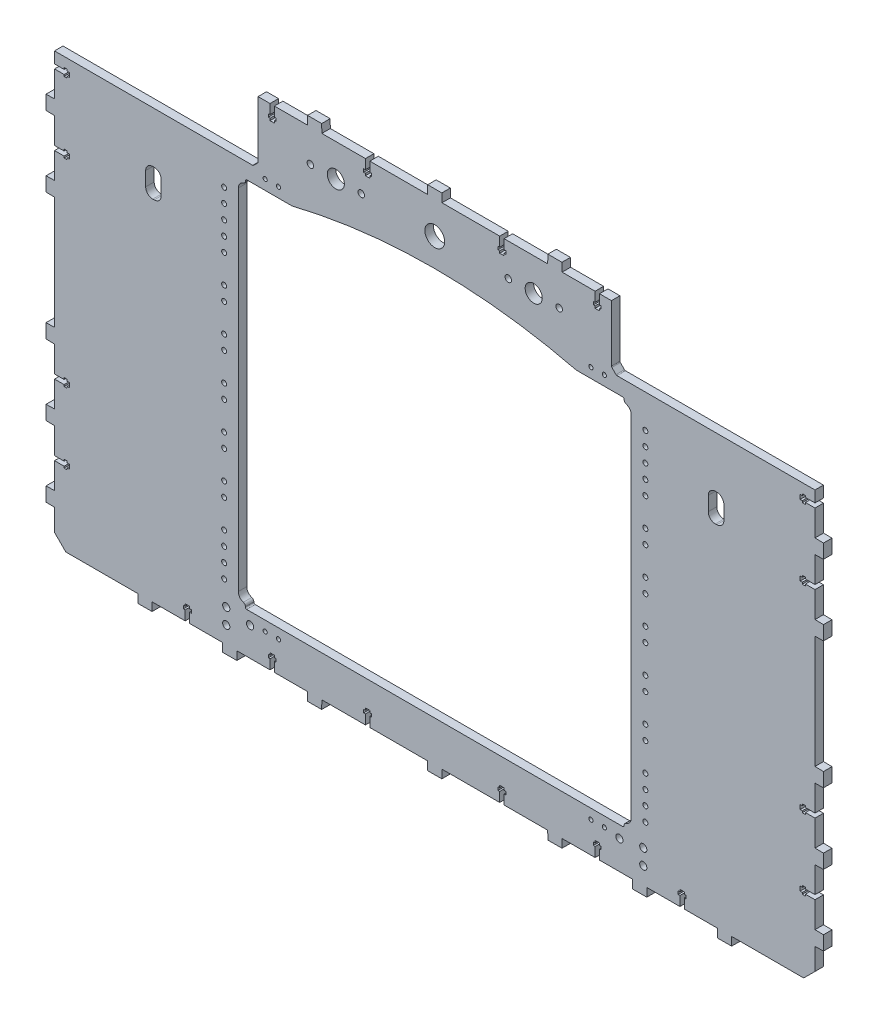
from build123d import *

# Parameters (mm, degrees)
SKETCH_1_R      = 1.75
SKETCH_1_R_2    = 2.55
SKETCH_1_R_3    = 1.5
SKETCH_1_R_4    = 2.3
SKETCH_1_R_5    = 6.05
SKETCH_1_R_6    = 7
EXTRUDE_1_DEPTH = 6


with BuildPart() as part:
    # Эскиз1 → Бобышка-Вытянуть1 (new body)
    with BuildSketch(Plane.XY):
        with BuildLine():
            Line((1433.580450761, 343.057239019), (1435.080450761, 343.057239019))
            Line((1435.080450761, 343.057239019), (1435.080450761, 339.95723902))
            Line((1435.080450761, 339.95723902), (1433.580450761, 339.95723902))
            Line((1433.580450761, 339.95723902), (1433.580450761, 338.75723902))
            Line((1433.580450761, 338.75723902), (1431.380450761, 338.75723902))
            Line((1431.380450761, 338.75723902), (1431.380450761, 339.95723902))
            Line((1431.380450761, 339.95723902), (1424.580450761, 339.95723902))
            Line((1424.580450761, 339.95723902), (1424.580450761, 321.60723902))
            Line((1424.580450761, 321.60723902), (1418.580450762, 321.50723902))
            Line((1418.580450762, 321.50723902), (1418.580450762, 311.50723902))
            Line((1418.580450762, 311.50723902), (1424.580450761, 311.407239019))
            Line((1424.580450761, 311.407239019), (1424.580450761, 293.05723902))
            Line((1424.580450761, 293.05723902), (1431.380450761, 293.05723902))
            Line((1431.380450761, 293.05723902), (1431.380450761, 294.25723902))
            Line((1431.380450761, 294.25723902), (1433.580450761, 294.25723902))
            Line((1433.580450761, 294.25723902), (1433.580450761, 293.05723902))
            Line((1433.580450761, 293.05723902), (1435.080450761, 293.05723902))
            Line((1435.080450761, 293.05723902), (1435.080450761, 289.95723902))
            Line((1435.080450761, 289.95723902), (1433.580450761, 289.95723902))
            Line((1433.580450761, 289.95723902), (1433.580450761, 288.75723902))
            Line((1433.580450761, 288.75723902), (1431.380450761, 288.75723902))
            Line((1431.380450761, 288.75723902), (1431.380450761, 289.95723902))
            Line((1431.380450761, 289.95723902), (1424.580450761, 289.95723902))
            Line((1424.580450761, 289.95723902), (1424.580450761, 271.60723902))
            Line((1424.580450761, 271.60723902), (1418.580450762, 271.50723902))
            Line((1418.580450762, 271.50723902), (1418.580450762, 261.50723902))
            Line((1418.580450762, 261.50723902), (1424.580450761, 261.407239019))
            Line((1424.580450761, 261.407239019), (1424.580450761, 181.60723902))
            Line((1424.580450761, 181.60723902), (1418.580450762, 181.50723902))
            Line((1418.580450762, 181.50723902), (1418.580450762, 171.50723902))
            Line((1418.580450762, 171.50723902), (1424.58045076, 171.407239019))
            Line((1424.58045076, 171.407239019), (1424.58045076, 153.05723902))
            Line((1424.58045076, 153.05723902), (1431.38045076, 153.05723902))
            Line((1431.38045076, 153.05723902), (1431.38045076, 154.257239019))
            Line((1431.38045076, 154.257239019), (1433.58045076, 154.257239019))
            Line((1433.58045076, 154.257239019), (1433.58045076, 153.057239019))
            Line((1433.58045076, 153.057239019), (1435.08045076, 153.057239019))
            Line((1435.08045076, 153.057239019), (1435.08045076, 149.957239019))
            Line((1435.08045076, 149.957239019), (1433.58045076, 149.957239019))
            Line((1433.58045076, 149.957239019), (1433.58045076, 148.757239019))
            Line((1433.58045076, 148.757239019), (1431.38045076, 148.757239019))
            Line((1431.38045076, 148.757239019), (1431.38045076, 149.957239019))
            Line((1431.38045076, 149.957239019), (1424.58045076, 149.957239019))
            Line((1424.58045076, 149.957239019), (1424.58045076, 131.607239019))
            Line((1424.58045076, 131.607239019), (1418.580450762, 131.507239019))
            Line((1418.580450762, 131.507239019), (1418.580450762, 121.507239019))
            Line((1418.580450762, 121.507239019), (1424.58045076, 121.407239018))
            Line((1424.58045076, 121.407239018), (1424.58045076, 103.057239019))
            Line((1424.58045076, 103.057239019), (1431.38045076, 103.057239019))
            Line((1431.38045076, 103.057239019), (1431.38045076, 104.257239019))
            Line((1431.38045076, 104.257239019), (1433.58045076, 104.257239019))
            Line((1433.58045076, 104.257239019), (1433.58045076, 103.057239019))
            Line((1433.58045076, 103.057239019), (1435.08045076, 103.057239019))
            Line((1435.08045076, 103.057239019), (1435.08045076, 99.957239019))
            Line((1435.08045076, 99.957239019), (1433.58045076, 99.957239019))
            Line((1433.58045076, 99.957239019), (1433.58045076, 98.757239019))
            Line((1433.58045076, 98.757239019), (1431.38045076, 98.757239019))
            Line((1431.38045076, 98.757239019), (1431.38045076, 99.957239019))
            Line((1431.38045076, 99.957239019), (1424.58045076, 99.957239019))
            Line((1424.58045076, 99.957239019), (1424.58045076, 81.607239019))
            Line((1424.58045076, 81.607239019), (1418.580450762, 81.507239019))
            Line((1418.580450762, 81.507239019), (1418.580450762, 71.507239019))
            Line((1418.580450762, 71.507239019), (1424.58045076, 71.407239018))
            Line((1424.58045076, 71.407239018), (1424.58045076, 56.007239019))
            Line((1424.58045076, 56.007239019), (1432.58045076, 48.007239019))
            Line((1432.58045076, 48.007239019), (1483.480450759, 48.007239019))
            Line((1483.480450759, 48.007239019), (1483.58045076, 42.00723902))
            Line((1483.58045076, 42.00723902), (1493.58045076, 42.00723902))
            Line((1493.58045076, 42.00723902), (1493.68045076, 48.007239019))
            Line((1493.68045076, 48.007239019), (1517.03045076, 48.007239019))
            Line((1517.03045076, 48.007239019), (1517.03045076, 54.807239019))
            Line((1517.03045076, 54.807239019), (1515.830450761, 54.807239019))
            Line((1515.830450761, 54.807239019), (1515.830450761, 57.007239019))
            Line((1515.830450761, 57.007239019), (1517.030450761, 57.007239019))
            Line((1517.030450761, 57.007239019), (1517.030450761, 58.507239019))
            Line((1517.030450761, 58.507239019), (1520.130450761, 58.507239019))
            Line((1520.130450761, 58.507239019), (1520.130450761, 57.007239019))
            Line((1520.130450761, 57.007239019), (1521.330450761, 57.007239019))
            Line((1521.330450761, 57.007239019), (1521.330450761, 54.807239019))
            Line((1521.330450761, 54.807239019), (1520.130450761, 54.807239019))
            Line((1520.130450761, 54.807239019), (1520.130450761, 48.007239019))
            Line((1520.130450761, 48.007239019), (1532.58045076, 48.007239019))
            Line((1532.58045076, 48.007239019), (1543.48045076, 48.007239019))
            Line((1543.48045076, 48.007239019), (1543.580450761, 42.00723902))
            Line((1543.580450761, 42.00723902), (1553.580450761, 42.00723902))
            Line((1553.580450761, 42.00723902), (1553.680450761, 48.007239018))
            Line((1553.680450761, 48.007239018), (1577.030450761, 48.007239018))
            Line((1577.030450761, 48.007239018), (1577.030450761, 54.807239018))
            Line((1577.030450761, 54.807239018), (1575.830450761, 54.807239018))
            Line((1575.830450761, 54.807239018), (1575.830450761, 57.007239018))
            Line((1575.830450761, 57.007239018), (1577.030450761, 57.007239018))
            Line((1577.030450761, 57.007239018), (1577.030450761, 58.507239018))
            Line((1577.030450761, 58.507239018), (1580.130450761, 58.507239018))
            Line((1580.130450761, 58.507239018), (1580.130450761, 57.007239018))
            Line((1580.130450761, 57.007239018), (1581.330450761, 57.007239018))
            Line((1581.330450761, 57.007239018), (1581.330450761, 54.807239018))
            Line((1581.330450761, 54.807239018), (1580.130450761, 54.807239018))
            Line((1580.130450761, 54.807239018), (1580.130450761, 48.007239018))
            Line((1580.130450761, 48.007239018), (1603.48045076, 48.007239018))
            Line((1603.48045076, 48.007239018), (1603.580450761, 42.007239019))
            Line((1603.580450761, 42.007239019), (1613.580450761, 42.007239019))
            Line((1613.580450761, 42.007239019), (1613.680450761, 48.007239017))
            Line((1613.680450761, 48.007239017), (1644.530450761, 48.007239017))
            Line((1644.530450761, 48.007239017), (1644.530450761, 54.807239017))
            Line((1644.530450761, 54.807239017), (1643.330450762, 54.807239017))
            Line((1643.330450762, 54.807239017), (1643.330450762, 57.007239017))
            Line((1643.330450762, 57.007239017), (1644.530450762, 57.007239017))
            Line((1644.530450762, 57.007239017), (1644.530450762, 58.507239017))
            Line((1644.530450762, 58.507239017), (1647.630450762, 58.507239017))
            Line((1647.630450762, 58.507239017), (1647.630450762, 57.007239017))
            Line((1647.630450762, 57.007239017), (1648.830450762, 57.007239017))
            Line((1648.830450762, 57.007239017), (1648.830450762, 54.807239017))
            Line((1648.830450762, 54.807239017), (1647.630450762, 54.807239017))
            Line((1647.630450762, 54.807239017), (1647.630450762, 48.007239017))
            Line((1647.630450762, 48.007239017), (1688.480450762, 48.007239017))
            Line((1688.480450762, 48.007239017), (1688.580450762, 42.007239019))
            Line((1688.580450762, 42.007239019), (1698.580450762, 42.007239019))
            Line((1698.580450762, 42.007239019), (1698.680450762, 48.007239017))
            Line((1698.680450762, 48.007239017), (1739.530450762, 48.007239017))
            Line((1739.530450762, 48.007239017), (1739.530450762, 54.807239017))
            Line((1739.530450762, 54.807239017), (1738.330450762, 54.807239017))
            Line((1738.330450762, 54.807239017), (1738.330450762, 57.007239017))
            Line((1738.330450762, 57.007239017), (1739.530450762, 57.007239017))
            Line((1739.530450762, 57.007239017), (1739.530450762, 58.507239017))
            Line((1739.530450762, 58.507239017), (1742.630450762, 58.507239017))
            Line((1742.630450762, 58.507239017), (1742.630450762, 57.007239017))
            Line((1742.630450762, 57.007239017), (1743.830450762, 57.007239017))
            Line((1743.830450762, 57.007239017), (1743.830450762, 54.807239017))
            Line((1743.830450762, 54.807239017), (1742.630450762, 54.807239017))
            Line((1742.630450762, 54.807239017), (1742.630450762, 48.007239017))
            Line((1742.630450762, 48.007239017), (1773.480450762, 48.007239017))
            Line((1773.480450762, 48.007239017), (1773.580450762, 42.007239018))
            Line((1773.580450762, 42.007239018), (1783.580450762, 42.007239018))
            Line((1783.580450762, 42.007239018), (1783.680450762, 48.007239017))
            Line((1783.680450762, 48.007239017), (1807.030450762, 48.007239017))
            Line((1807.030450762, 48.007239017), (1807.030450762, 54.807239017))
            Line((1807.030450762, 54.807239017), (1805.830450762, 54.807239017))
            Line((1805.830450762, 54.807239017), (1805.830450762, 57.007239017))
            Line((1805.830450762, 57.007239017), (1807.030450762, 57.007239017))
            Line((1807.030450762, 57.007239017), (1807.030450762, 58.507239017))
            Line((1807.030450762, 58.507239017), (1810.130450762, 58.507239017))
            Line((1810.130450762, 58.507239017), (1810.130450762, 57.007239017))
            Line((1810.130450762, 57.007239017), (1811.330450762, 57.007239017))
            Line((1811.330450762, 57.007239017), (1811.330450762, 54.807239017))
            Line((1811.330450762, 54.807239017), (1810.130450762, 54.807239017))
            Line((1810.130450762, 54.807239017), (1810.130450762, 48.007239017))
            Line((1810.130450762, 48.007239017), (1833.480450762, 48.007239017))
            Line((1833.480450762, 48.007239017), (1833.580450762, 42.007239018))
            Line((1833.580450762, 42.007239018), (1843.580450762, 42.007239018))
            Line((1843.580450762, 42.007239018), (1843.680450762, 48.007239017))
            Line((1843.680450762, 48.007239017), (1854.580450762, 48.007239017))
            Line((1854.580450762, 48.007239017), (1867.030450762, 48.007239017))
            Line((1867.030450762, 48.007239017), (1867.030450762, 54.807239017))
            Line((1867.030450762, 54.807239017), (1865.830450762, 54.807239017))
            Line((1865.830450762, 54.807239017), (1865.830450762, 57.007239017))
            Line((1865.830450762, 57.007239017), (1867.030450762, 57.007239017))
            Line((1867.030450762, 57.007239017), (1867.030450762, 58.507239017))
            Line((1867.030450762, 58.507239017), (1870.130450762, 58.507239017))
            Line((1870.130450762, 58.507239017), (1870.130450762, 57.007239017))
            Line((1870.130450762, 57.007239017), (1871.330450762, 57.007239017))
            Line((1871.330450762, 57.007239017), (1871.330450762, 54.807239017))
            Line((1871.330450762, 54.807239017), (1870.130450762, 54.807239017))
            Line((1870.130450762, 54.807239017), (1870.130450762, 48.007239017))
            Line((1870.130450762, 48.007239017), (1893.480450762, 48.007239017))
            Line((1893.480450762, 48.007239017), (1893.580450762, 42.007239018))
            Line((1893.580450762, 42.007239018), (1903.580450762, 42.007239018))
            Line((1903.580450762, 42.007239018), (1903.680450762, 48.007239017))
            Line((1903.680450762, 48.007239017), (1954.580450762, 48.007239017))
            Line((1954.580450762, 48.007239017), (1962.580450762, 56.007239017))
            Line((1962.580450762, 56.007239017), (1962.580450762, 71.407239016))
            Line((1962.580450762, 71.407239016), (1968.58045076, 71.507239016))
            Line((1968.58045076, 71.507239016), (1968.58045076, 81.507239016))
            Line((1968.58045076, 81.507239016), (1962.580450762, 81.607239016))
            Line((1962.580450762, 81.607239016), (1962.580450762, 99.957239016))
            Line((1962.580450762, 99.957239016), (1955.780450762, 99.957239016))
            Line((1955.780450762, 99.957239016), (1955.780450762, 98.757239016))
            Line((1955.780450762, 98.757239016), (1953.580450762, 98.757239016))
            Line((1953.580450762, 98.757239016), (1953.580450762, 99.957239016))
            Line((1953.580450762, 99.957239016), (1952.080450762, 99.957239016))
            Line((1952.080450762, 99.957239016), (1952.080450762, 103.057239016))
            Line((1952.080450762, 103.057239016), (1953.580450762, 103.057239016))
            Line((1953.580450762, 103.057239016), (1953.580450762, 104.257239016))
            Line((1953.580450762, 104.257239016), (1955.780450762, 104.257239016))
            Line((1955.780450762, 104.257239016), (1955.780450762, 103.057239016))
            Line((1955.780450762, 103.057239016), (1962.580450762, 103.057239016))
            Line((1962.580450762, 103.057239016), (1962.580450762, 121.407239016))
            Line((1962.580450762, 121.407239016), (1968.58045076, 121.507239016))
            Line((1968.58045076, 121.507239016), (1968.58045076, 131.507239016))
            Line((1968.58045076, 131.507239016), (1962.580450762, 131.607239016))
            Line((1962.580450762, 131.607239016), (1962.580450762, 149.957239016))
            Line((1962.580450762, 149.957239016), (1955.780450762, 149.957239016))
            Line((1955.780450762, 149.957239016), (1955.780450762, 148.757239016))
            Line((1955.780450762, 148.757239016), (1953.580450762, 148.757239016))
            Line((1953.580450762, 148.757239016), (1953.580450762, 149.957239016))
            Line((1953.580450762, 149.957239016), (1952.080450762, 149.957239016))
            Line((1952.080450762, 149.957239016), (1952.080450762, 153.057239016))
            Line((1952.080450762, 153.057239016), (1953.580450762, 153.057239016))
            Line((1953.580450762, 153.057239016), (1953.580450762, 154.257239016))
            Line((1953.580450762, 154.257239016), (1955.780450762, 154.257239016))
            Line((1955.780450762, 154.257239016), (1955.780450762, 153.057239016))
            Line((1955.780450762, 153.057239016), (1962.580450762, 153.057239016))
            Line((1962.580450762, 153.057239016), (1962.580450762, 171.407239016))
            Line((1962.580450762, 171.407239016), (1968.58045076, 171.507239016))
            Line((1968.58045076, 171.507239016), (1968.58045076, 181.507239016))
            Line((1968.58045076, 181.507239016), (1962.580450762, 181.607239016))
            Line((1962.580450762, 181.607239016), (1962.580450762, 261.407239016))
            Line((1962.580450762, 261.407239016), (1968.58045076, 261.507239017))
            Line((1968.58045076, 261.507239017), (1968.58045076, 271.507239017))
            Line((1968.58045076, 271.507239017), (1962.580450762, 271.607239017))
            Line((1962.580450762, 271.607239017), (1962.580450762, 289.957239017))
            Line((1962.580450762, 289.957239017), (1955.780450762, 289.957239017))
            Line((1955.780450762, 289.957239017), (1955.780450762, 288.757239017))
            Line((1955.780450762, 288.757239017), (1953.580450762, 288.757239017))
            Line((1953.580450762, 288.757239017), (1953.580450762, 289.957239017))
            Line((1953.580450762, 289.957239017), (1952.080450762, 289.957239017))
            Line((1952.080450762, 289.957239017), (1952.080450762, 293.057239017))
            Line((1952.080450762, 293.057239017), (1953.580450762, 293.057239017))
            Line((1953.580450762, 293.057239017), (1953.580450762, 294.257239017))
            Line((1953.580450762, 294.257239017), (1955.780450762, 294.257239017))
            Line((1955.780450762, 294.257239017), (1955.780450762, 293.057239017))
            Line((1955.780450762, 293.057239017), (1962.580450762, 293.057239017))
            Line((1962.580450762, 293.057239017), (1962.580450762, 311.407239016))
            Line((1962.580450762, 311.407239016), (1968.58045076, 311.507239017))
            Line((1968.58045076, 311.507239017), (1968.58045076, 321.507239017))
            Line((1968.58045076, 321.507239017), (1962.580450762, 321.607239017))
            Line((1962.580450762, 321.607239017), (1962.580450762, 339.957239017))
            Line((1962.580450762, 339.957239017), (1955.780450762, 339.957239017))
            Line((1955.780450762, 339.957239017), (1955.780450762, 338.757239018))
            Line((1955.780450762, 338.757239018), (1953.580450762, 338.757239018))
            Line((1953.580450762, 338.757239018), (1953.580450762, 339.957239018))
            Line((1953.580450762, 339.957239018), (1952.080450762, 339.957239018))
            Line((1952.080450762, 339.957239018), (1952.080450762, 343.057239018))
            Line((1952.080450762, 343.057239018), (1953.580450762, 343.057239018))
            Line((1953.580450762, 343.057239018), (1953.580450762, 344.257239018))
            Line((1953.580450762, 344.257239018), (1955.780450762, 344.257239018))
            Line((1955.780450762, 344.257239018), (1955.780450762, 343.057239018))
            Line((1955.780450762, 343.057239018), (1962.580450762, 343.057239018))
            Line((1962.580450762, 343.057239018), (1962.580450762, 351.007239019))
            Line((1962.580450762, 351.007239019), (1862.580450762, 351.007239019))
            Line((1862.580450762, 351.007239019), (1822.494664324, 351.007239019))
            ThreePointArc((1822.494664324, 351.007239019), (1822.111980892, 351.083359486), (1821.787557543, 351.300132238))
            Line((1821.787557543, 351.300132238), (1818.87334398, 354.2143458))
            ThreePointArc((1818.87334398, 354.2143458), (1818.656571229, 354.538769149), (1818.580450762, 354.921452581))
            Line((1818.580450762, 354.921452581), (1818.580450762, 395.007239019))
            Line((1818.580450762, 395.007239019), (1810.130450762, 395.007239019))
            Line((1810.130450762, 395.007239019), (1810.130450762, 388.207239019))
            Line((1810.130450762, 388.207239019), (1811.330450761, 388.207239019))
            Line((1811.330450761, 388.207239019), (1811.330450761, 386.007239019))
            Line((1811.330450761, 386.007239019), (1810.130450761, 386.007239019))
            Line((1810.130450761, 386.007239019), (1810.130450761, 384.507239019))
            Line((1810.130450761, 384.507239019), (1807.030450761, 384.507239019))
            Line((1807.030450761, 384.507239019), (1807.030450761, 386.007239019))
            Line((1807.030450761, 386.007239019), (1805.830450761, 386.007239019))
            Line((1805.830450761, 386.007239019), (1805.830450761, 388.207239019))
            Line((1805.830450761, 388.207239019), (1807.030450761, 388.207239019))
            Line((1807.030450761, 388.207239019), (1807.030450761, 395.007239019))
            Line((1807.030450761, 395.007239019), (1783.680450762, 395.007239019))
            Line((1783.680450762, 395.007239019), (1783.580450761, 401.007239017))
            Line((1783.580450761, 401.007239017), (1773.580450761, 401.007239017))
            Line((1773.580450761, 401.007239017), (1773.480450761, 395.007239019))
            Line((1773.480450761, 395.007239019), (1742.630450761, 395.007239019))
            Line((1742.630450761, 395.007239019), (1742.630450761, 388.207239019))
            Line((1742.630450761, 388.207239019), (1743.83045076, 388.207239019))
            Line((1743.83045076, 388.207239019), (1743.83045076, 386.007239019))
            Line((1743.83045076, 386.007239019), (1742.63045076, 386.007239019))
            Line((1742.63045076, 386.007239019), (1742.63045076, 384.507239019))
            Line((1742.63045076, 384.507239019), (1739.53045076, 384.507239019))
            Line((1739.53045076, 384.507239019), (1739.53045076, 386.007239019))
            Line((1739.53045076, 386.007239019), (1738.33045076, 386.007239019))
            Line((1738.33045076, 386.007239019), (1738.33045076, 388.207239019))
            Line((1738.33045076, 388.207239019), (1739.53045076, 388.207239019))
            Line((1739.53045076, 388.207239019), (1739.53045076, 395.007239019))
            Line((1739.53045076, 395.007239019), (1698.680450761, 395.007239019))
            Line((1698.680450761, 395.007239019), (1698.58045076, 401.007239017))
            Line((1698.58045076, 401.007239017), (1688.58045076, 401.007239017))
            Line((1688.58045076, 401.007239017), (1688.48045076, 395.007239019))
            Line((1688.48045076, 395.007239019), (1647.63045076, 395.007239019))
            Line((1647.63045076, 395.007239019), (1647.63045076, 388.207239019))
            Line((1647.63045076, 388.207239019), (1648.83045076, 388.207239019))
            Line((1648.83045076, 388.207239019), (1648.83045076, 386.007239019))
            Line((1648.83045076, 386.007239019), (1647.63045076, 386.007239019))
            Line((1647.63045076, 386.007239019), (1647.63045076, 384.507239019))
            Line((1647.63045076, 384.507239019), (1644.53045076, 384.507239019))
            Line((1644.53045076, 384.507239019), (1644.53045076, 386.007239019))
            Line((1644.53045076, 386.007239019), (1643.33045076, 386.007239019))
            Line((1643.33045076, 386.007239019), (1643.33045076, 388.207239019))
            Line((1643.33045076, 388.207239019), (1644.53045076, 388.207239019))
            Line((1644.53045076, 388.207239019), (1644.53045076, 395.007239019))
            Line((1644.53045076, 395.007239019), (1613.680450761, 395.007239019))
            Line((1613.680450761, 395.007239019), (1613.58045076, 401.007239017))
            Line((1613.58045076, 401.007239017), (1603.58045076, 401.007239017))
            Line((1603.58045076, 401.007239017), (1603.48045076, 395.007239019))
            Line((1603.48045076, 395.007239019), (1580.13045076, 395.007239019))
            Line((1580.13045076, 395.007239019), (1580.13045076, 388.207239019))
            Line((1580.13045076, 388.207239019), (1581.33045076, 388.207239019))
            Line((1581.33045076, 388.207239019), (1581.33045076, 386.007239019))
            Line((1581.33045076, 386.007239019), (1580.13045076, 386.007239019))
            Line((1580.13045076, 386.007239019), (1580.13045076, 384.507239019))
            Line((1580.13045076, 384.507239019), (1577.03045076, 384.507239019))
            Line((1577.03045076, 384.507239019), (1577.03045076, 386.007239019))
            Line((1577.03045076, 386.007239019), (1575.83045076, 386.007239019))
            Line((1575.83045076, 386.007239019), (1575.83045076, 388.207239019))
            Line((1575.83045076, 388.207239019), (1577.03045076, 388.207239019))
            Line((1577.03045076, 388.207239019), (1577.03045076, 395.007239019))
            Line((1577.03045076, 395.007239019), (1568.58045076, 395.007239019))
            Line((1568.58045076, 395.007239019), (1568.58045076, 354.921452581))
            ThreePointArc((1568.58045076, 354.921452581), (1568.504330293, 354.538769149), (1568.287557541, 354.2143458))
            Line((1568.287557541, 354.2143458), (1565.373343979, 351.300132238))
            ThreePointArc((1565.373343979, 351.300132238), (1565.04892063, 351.083359486), (1564.666237198, 351.007239019))
            Line((1564.666237198, 351.007239019), (1524.58045076, 351.007239019))
            Line((1524.58045076, 351.007239019), (1424.580450761, 351.007239019))
            Line((1424.580450761, 351.007239019), (1424.580450761, 343.057239019))
            Line((1424.580450761, 343.057239019), (1431.380450761, 343.057239019))
            Line((1431.380450761, 343.057239019), (1431.380450761, 344.257239019))
            Line((1431.380450761, 344.257239019), (1433.580450761, 344.257239019))
            Line((1433.580450761, 344.257239019), (1433.580450761, 343.057239019))
        make_face()
        with Locations((1544.58045076, 177.507239237)):
            Circle(SKETCH_1_R, mode=Mode.SUBTRACT)
        with Locations((1544.58045076, 147.507239237)):
            Circle(SKETCH_1_R, mode=Mode.SUBTRACT)
        with Locations((1544.58045076, 137.507239237)):
            Circle(SKETCH_1_R, mode=Mode.SUBTRACT)
        with Locations((1544.58045076, 117.507239237)):
            Circle(SKETCH_1_R, mode=Mode.SUBTRACT)
        with Locations((1544.58045076, 107.507239237)):
            Circle(SKETCH_1_R, mode=Mode.SUBTRACT)
        with Locations((1544.58045076, 97.507239237)):
            Circle(SKETCH_1_R, mode=Mode.SUBTRACT)
        with Locations((1544.58045076, 87.507239237)):
            Circle(SKETCH_1_R, mode=Mode.SUBTRACT)
        with Locations((1546.08045076, 71.007239019)):
            Circle(SKETCH_1_R_2, mode=Mode.SUBTRACT)
        with Locations((1546.08045076, 60.007239019)):
            Circle(SKETCH_1_R_2, mode=Mode.SUBTRACT)
        with Locations((1544.58045076, 197.507239237)):
            Circle(SKETCH_1_R, mode=Mode.SUBTRACT)
        with Locations((1544.58045076, 207.507239237)):
            Circle(SKETCH_1_R, mode=Mode.SUBTRACT)
        with Locations((1544.58045076, 227.507239237)):
            Circle(SKETCH_1_R, mode=Mode.SUBTRACT)
        with Locations((1544.58045076, 237.507239237)):
            Circle(SKETCH_1_R, mode=Mode.SUBTRACT)
        with Locations((1544.58045076, 257.507239237)):
            Circle(SKETCH_1_R, mode=Mode.SUBTRACT)
        with Locations((1544.58045076, 267.507239237)):
            Circle(SKETCH_1_R, mode=Mode.SUBTRACT)
        with Locations((1544.58045076, 287.507239237)):
            Circle(SKETCH_1_R, mode=Mode.SUBTRACT)
        with Locations((1544.58045076, 297.507239237)):
            Circle(SKETCH_1_R, mode=Mode.SUBTRACT)
        with Locations((1544.58045076, 307.507239237)):
            Circle(SKETCH_1_R, mode=Mode.SUBTRACT)
        with Locations((1544.58045076, 317.507239237)):
            Circle(SKETCH_1_R, mode=Mode.SUBTRACT)
        with Locations((1544.58045076, 327.507239237)):
            Circle(SKETCH_1_R, mode=Mode.SUBTRACT)
        with Locations((1573.58045076, 347.007239019)):
            Circle(SKETCH_1_R_3, mode=Mode.SUBTRACT)
        with Locations((1583.08045076, 347.007239019)):
            Circle(SKETCH_1_R_3, mode=Mode.SUBTRACT)
        with Locations((1605.58045076, 372.007239019)):
            Circle(SKETCH_1_R_4, mode=Mode.SUBTRACT)
        with Locations((1623.58045076, 372.007239019)):
            Circle(SKETCH_1_R_5, mode=Mode.SUBTRACT)
        with Locations((1641.58045076, 372.007239019)):
            Circle(SKETCH_1_R_4, mode=Mode.SUBTRACT)
        with Locations((1693.58045076, 372.007239019)):
            Circle(SKETCH_1_R_6, mode=Mode.SUBTRACT)
        with Locations((1745.58045076, 372.007239019)):
            Circle(SKETCH_1_R_4, mode=Mode.SUBTRACT)
        with Locations((1763.58045076, 372.007239019)):
            Circle(SKETCH_1_R_5, mode=Mode.SUBTRACT)
        with Locations((1781.58045076, 372.007239019)):
            Circle(SKETCH_1_R_4, mode=Mode.SUBTRACT)
        with Locations((1804.08045076, 347.007239019)):
            Circle(SKETCH_1_R_3, mode=Mode.SUBTRACT)
        with Locations((1813.58045076, 347.007239019)):
            Circle(SKETCH_1_R_3, mode=Mode.SUBTRACT)
        with Locations((1842.58045076, 327.507239019)):
            Circle(SKETCH_1_R, mode=Mode.SUBTRACT)
        with Locations((1842.58045076, 317.507239019)):
            Circle(SKETCH_1_R, mode=Mode.SUBTRACT)
        with Locations((1842.58045076, 307.507239019)):
            Circle(SKETCH_1_R, mode=Mode.SUBTRACT)
        with Locations((1842.58045076, 297.507239019)):
            Circle(SKETCH_1_R, mode=Mode.SUBTRACT)
        with Locations((1842.58045076, 287.507239019)):
            Circle(SKETCH_1_R, mode=Mode.SUBTRACT)
        with Locations((1842.58045076, 267.507239019)):
            Circle(SKETCH_1_R, mode=Mode.SUBTRACT)
        with Locations((1842.58045076, 257.507239019)):
            Circle(SKETCH_1_R, mode=Mode.SUBTRACT)
        with Locations((1842.58045076, 237.507239019)):
            Circle(SKETCH_1_R, mode=Mode.SUBTRACT)
        with Locations((1842.58045076, 227.507239019)):
            Circle(SKETCH_1_R, mode=Mode.SUBTRACT)
        with Locations((1842.58045076, 207.507239019)):
            Circle(SKETCH_1_R, mode=Mode.SUBTRACT)
        with Locations((1842.58045076, 197.507239019)):
            Circle(SKETCH_1_R, mode=Mode.SUBTRACT)
        with Locations((1842.58045076, 177.507239019)):
            Circle(SKETCH_1_R, mode=Mode.SUBTRACT)
        with Locations((1842.58045076, 167.507239019)):
            Circle(SKETCH_1_R, mode=Mode.SUBTRACT)
        with Locations((1842.58045076, 147.507239019)):
            Circle(SKETCH_1_R, mode=Mode.SUBTRACT)
        with Locations((1842.58045076, 137.507239019)):
            Circle(SKETCH_1_R, mode=Mode.SUBTRACT)
        with Locations((1842.58045076, 117.507239019)):
            Circle(SKETCH_1_R, mode=Mode.SUBTRACT)
        with Locations((1842.58045076, 107.507239019)):
            Circle(SKETCH_1_R, mode=Mode.SUBTRACT)
        with Locations((1842.58045076, 97.507239019)):
            Circle(SKETCH_1_R, mode=Mode.SUBTRACT)
        with Locations((1842.58045076, 87.507239019)):
            Circle(SKETCH_1_R, mode=Mode.SUBTRACT)
        with Locations((1841.08045076, 71.007239019)):
            Circle(SKETCH_1_R_2, mode=Mode.SUBTRACT)
        with Locations((1841.08045076, 60.007239019)):
            Circle(SKETCH_1_R_2, mode=Mode.SUBTRACT)
        with Locations((1824.227659727, 68.296772665)):
            Circle(SKETCH_1_R_2, mode=Mode.SUBTRACT)
        with Locations((1813.58045076, 69.78654025)):
            Circle(SKETCH_1_R_3, mode=Mode.SUBTRACT)
        with Locations((1804.08045076, 69.78654025)):
            Circle(SKETCH_1_R_3, mode=Mode.SUBTRACT)
        with Locations((1583.08045076, 69.78654025)):
            Circle(SKETCH_1_R_3, mode=Mode.SUBTRACT)
        with Locations((1573.58045076, 69.78654025)):
            Circle(SKETCH_1_R_3, mode=Mode.SUBTRACT)
        with Locations((1562.93045076, 68.296772665)):
            Circle(SKETCH_1_R_2, mode=Mode.SUBTRACT)
        with Locations((1544.58045076, 167.507239237)):
            Circle(SKETCH_1_R, mode=Mode.SUBTRACT)
        with BuildLine():
            Line((1560.58045076, 76.78654025), (1826.579713792, 76.78654025))
            ThreePointArc((1826.579713792, 76.78654025), (1827.286820573, 77.079433469), (1827.579713792, 77.78654025))
            Line((1827.579713792, 77.78654025), (1827.579713792, 78.078336318))
            ThreePointArc((1827.579713792, 78.078336318), (1827.976146341, 79.273564927), (1829.008285221, 79.994966013))
            ThreePointArc((1829.008285221, 79.994966013), (1831.588627971, 81.798462757), (1832.579713792, 84.786525358))
            Line((1832.579713792, 84.786525358), (1832.580467982, 332.007224127))
            ThreePointArc((1832.580467982, 332.007224127), (1831.589391061, 334.995304572), (1829.009039411, 336.798813256))
            ThreePointArc((1829.009039411, 336.798813256), (1827.976900531, 337.520214342), (1827.580467982, 338.715442951))
            Line((1827.580467982, 338.715442951), (1827.580467982, 339.007239019))
            ThreePointArc((1827.580467982, 339.007239019), (1827.287574764, 339.7143458), (1826.580467982, 340.007239019))
            Line((1826.580467982, 340.007239019), (1793.680450761, 340.007239019))
            ThreePointArc((1793.680450761, 340.007239019), (1693.122117427, 352.15701974), (1592.563784093, 340.007239019))
            Line((1592.563784093, 340.007239019), (1560.58045076, 340.007239019))
            ThreePointArc((1560.58045076, 340.007239019), (1559.873343979, 339.7143458), (1559.58045076, 339.007239019))
            Line((1559.58045076, 339.007239019), (1559.58045076, 338.715442951))
            ThreePointArc((1559.58045076, 338.715442951), (1559.184018212, 337.520214342), (1558.151879332, 336.798813256))
            ThreePointArc((1558.151879332, 336.798813256), (1555.571532132, 334.995310542), (1554.58045076, 332.007239019))
            Line((1554.58045076, 332.007239019), (1554.58045076, 84.78654025))
            ThreePointArc((1554.58045076, 84.78654025), (1555.571532132, 81.798468727), (1558.151879332, 79.994966012))
            ThreePointArc((1558.151879332, 79.994966012), (1559.184018212, 79.273564927), (1559.58045076, 78.078336317))
            Line((1559.58045076, 78.078336317), (1559.58045076, 77.78654025))
            ThreePointArc((1559.58045076, 77.78654025), (1559.873343979, 77.079433469), (1560.58045076, 76.78654025))
        make_face(mode=Mode.SUBTRACT)
        with BuildLine():
            Line((1892.08045076, 314.95723902), (1893.08045076, 314.95723902))
            ThreePointArc((1893.08045076, 314.95723902), (1896.615984666, 313.492772926), (1898.08045076, 309.95723902))
            Line((1898.08045076, 309.95723902), (1898.08045076, 299.95723902))
            ThreePointArc((1898.08045076, 299.95723902), (1896.615984666, 296.421705114), (1893.08045076, 294.95723902))
            Line((1893.08045076, 294.95723902), (1892.08045076, 294.95723902))
            ThreePointArc((1892.08045076, 294.95723902), (1888.544916854, 296.421705114), (1887.08045076, 299.95723902))
            Line((1887.08045076, 299.95723902), (1887.08045076, 309.95723902))
            ThreePointArc((1887.08045076, 309.95723902), (1888.544916854, 313.492772926), (1892.08045076, 314.95723902))
        make_face(mode=Mode.SUBTRACT)
        with BuildLine():
            Line((1495.08045076, 294.95723902), (1494.08045076, 294.95723902))
            ThreePointArc((1494.08045076, 294.95723902), (1490.544916854, 296.421705114), (1489.08045076, 299.95723902))
            Line((1489.08045076, 299.95723902), (1489.08045076, 309.95723902))
            ThreePointArc((1489.08045076, 309.95723902), (1490.544916854, 313.492772926), (1494.08045076, 314.95723902))
            Line((1494.08045076, 314.95723902), (1495.08045076, 314.95723902))
            ThreePointArc((1495.08045076, 314.95723902), (1498.615984666, 313.492772926), (1500.08045076, 309.95723902))
            Line((1500.08045076, 309.95723902), (1500.08045076, 299.95723902))
            ThreePointArc((1500.08045076, 299.95723902), (1498.615984666, 296.421705114), (1495.08045076, 294.95723902))
        make_face(mode=Mode.SUBTRACT)
    extrude(amount=EXTRUDE_1_DEPTH)


solid = part.part
